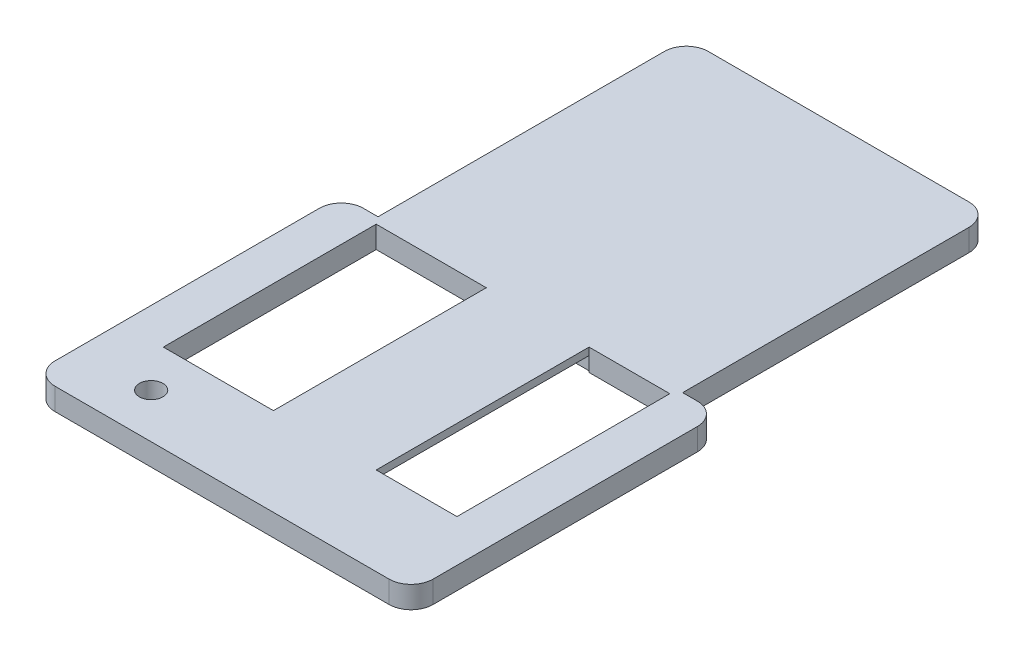
from build123d import *

# Parameters (mm, degrees)
BOSS_EXTRUDE1_DEPTH = 3
FILLET1_R           = 3
SKETCH2_R           = 1.6
SKETCH2_W           = 15
SKETCH2_H           = 29
SKETCH2_W_2         = 11
CUT_EXTRUDE1_DEPTH  = 3
SKETCH4_W           = 14
SKETCH4_H           = 29.4
CUT_EXTRUDE2_DEPTH  = 2


with BuildPart() as part:
    # Sketch1 → Boss-Extrude1 (new body)
    with BuildSketch(Plane(origin=(0, 0, 0), x_dir=(1, 0, 0), z_dir=(0, 1, 0))):
        Polygon((-20.75, 42), (-20.75, 0), (-25.75, 0), (-25.75, -42), (25.75, -42), (25.75, 0), (20.75, 0), (20.75, 42), align=None)
    extrude(amount=BOSS_EXTRUDE1_DEPTH)

    # Fillet1
    fillet1_edges = [part.edges().sort_by_distance(p)[0] for p in [
        (20.75, 1.5, -42),
        (25.75, 1.5, 0),
        (25.75, 1.5, 42),
        (-25.75, 1.5, 42),
        (-25.75, 1.5, 0),
        (-20.75, 1.5, -42),
    ]]
    fillet(fillet1_edges, radius=FILLET1_R)

    # Sketch2 → Cut-Extrude1 (cut)
    with BuildSketch(Plane(origin=(0, 3, 0), x_dir=(1, 0, 0), z_dir=(0, 1, 0))):
        with Locations(Location((-15.75, -35.907418342, 0), (0, 0, 270))):
            Circle(SKETCH2_R)
        with Locations((-12.5, -15.5)):
            Rectangle(SKETCH2_W, SKETCH2_H)
        with Locations((14.5, -15.5)):
            Rectangle(SKETCH2_W_2, SKETCH2_H)
    extrude(amount=-CUT_EXTRUDE1_DEPTH, mode=Mode.SUBTRACT)

    # Sketch4 → Cut-Extrude2 (cut)
    with BuildSketch(Plane.XZ):
        with Locations((2, 15.5)):
            Rectangle(SKETCH4_W, SKETCH4_H)
    extrude(amount=-CUT_EXTRUDE2_DEPTH, mode=Mode.SUBTRACT)


solid = part.part
